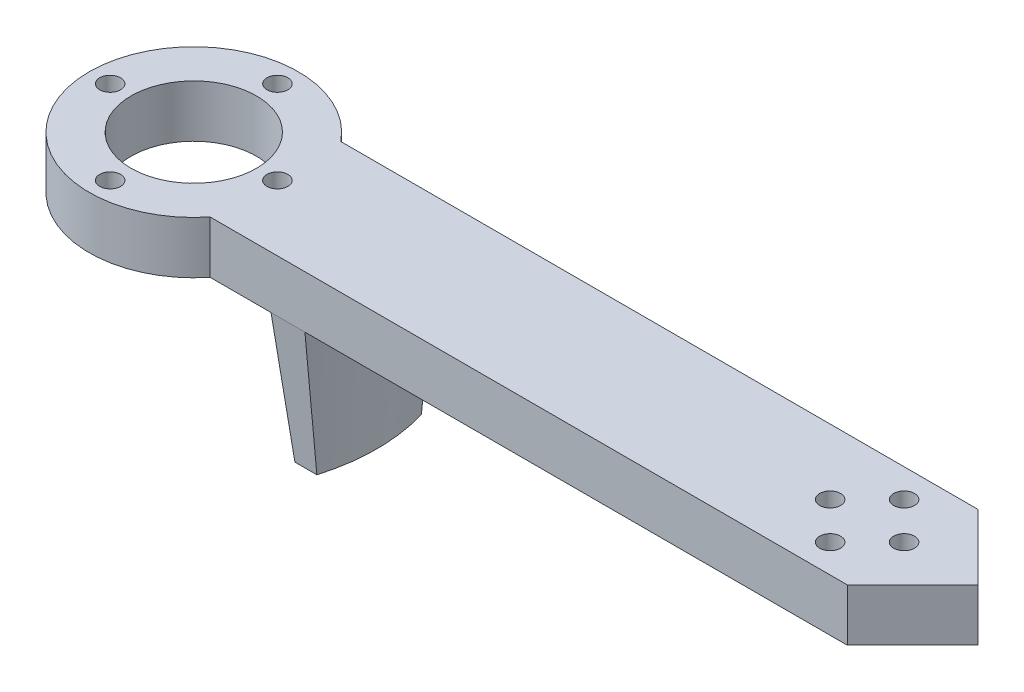
from build123d import *

# Parameters (mm, degrees)
SKETCH_1_R          = 2
EXTRUDE_1_DEPTH     = 10
SKETCH_2_R          = 2
CUT_EXTRUDE_1_DEPTH = 10


with BuildPart() as part:
    # 스케치1 → 보스-돌출1 (new body)
    with BuildSketch(Plane(origin=(0, 0, 0), x_dir=(1, 0, 0), z_dir=(0, 1, 0))):
        with BuildLine():
            ThreePointArc((-59.387505004, 12.5), (-95, 0), (-59.387505004, -12.5))
            Line((-59.387505004, -12.5), (62.5, -12.5))
            Line((62.5, -12.5), (75, 0))
            Line((75, 0), (62.5, 12.5))
            Line((62.5, 12.5), (-59.387505004, 12.5))
        make_face()
        with Locations(Location((-75, -16, 0), (0, 0, 270))):
            Circle(SKETCH_1_R, mode=Mode.SUBTRACT)
        with Locations(Location((-91, 0, 0), (0, 0, 270))):
            Circle(SKETCH_1_R, mode=Mode.SUBTRACT)
        with BuildLine():
            ThreePointArc((-75, 12), (-66.514718626, 8.485281374), (-63, 0))
            ThreePointArc((-63, 0), (-83.485281374, -8.485281374), (-75, 12))
        make_face(mode=Mode.SUBTRACT)
        with BuildLine():
            ThreePointArc((-61, 0), (-59, 2), (-57, 0))
            ThreePointArc((-57, 0), (-59, -2), (-61, 0))
        make_face(mode=Mode.SUBTRACT)
        with Locations(Location((-75, 16, 0), (0, 0, 270))):
            Circle(SKETCH_1_R, mode=Mode.SUBTRACT)
    extrude(amount=EXTRUDE_1_DEPTH)

    # 스케치2 → 컷-돌출1 (cut)
    with BuildSketch(Plane(origin=(0, 0, 0), x_dir=(1, 0, 0), z_dir=(0, 1, 0))):
        with Locations(Location((53.786796564, 7.071067812, 0), (0, 0, 270))):
            Circle(SKETCH_2_R)
        with Locations(Location((60.857864376, 0, 0), (0, 0, 270))):
            Circle(SKETCH_2_R)
        with Locations(Location((46.715728753, 0, 0), (0, 0, 270))):
            Circle(SKETCH_2_R)
        with Locations(Location((53.786796564, -7.071067812, 0), (0, 0, 270))):
            Circle(SKETCH_2_R)
    extrude(amount=CUT_EXTRUDE_1_DEPTH, mode=Mode.SUBTRACT)

    # 스케치3 for 로프트1 → 로프트1 section 0
    with BuildSketch(Plane(origin=(0, 0, 0), x_dir=(1, 0, 0), z_dir=(0, 1, 0))):
        with BuildLine():
            Line((-41.239816351, 12.5), (-47.728219713, 12.5))
            # circular arc as an exact rational Bezier (weights 1, cos(half-angle), 1)
            Bezier((-47.728219713, 12.5), (-41.998854107, 0), (-47.728219713, -12.5), weights=[1, 0.909059343, 1])
            Line((-47.728219713, -12.5), (-41.239816351, -12.5))
            Bezier((-41.239816351, -12.5), (-36.611583234, 0), (-41.239816351, 12.5), weights=[1, 0.937782879, 1])
        make_face()
    # 스케치4 for 로프트1 → 로프트1 section 1
    with BuildSketch(Plane(origin=(0, -25, 0), x_dir=(1, 0, 0), z_dir=(0, 1, 0))):
        with BuildLine():
            Line((-45.657198498, -10), (-41.458980338, -10))
            Bezier((-41.458980338, -10), (-38.477556368, 0), (-41.458980338, 10), weights=[1, 0.958314847, 1])
            Line((-41.458980338, 10), (-45.657198498, 10))
            Bezier((-45.657198498, 10), (-42.249207615, 0), (-45.657198498, -10), weights=[1, 0.946541984, 1])
        make_face()
    loft()


solid = part.part
